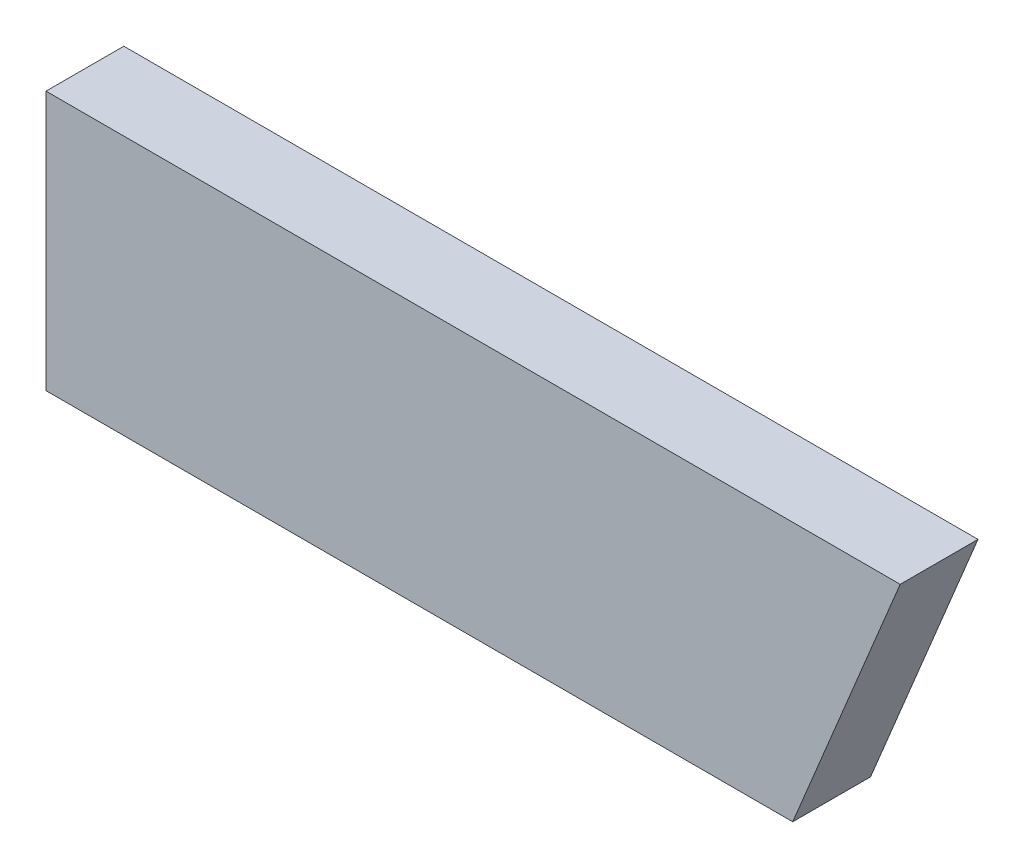
from build123d import *

# Parameters (mm, degrees)
BOSS_EXTRUDE1_DEPTH = 19.05


with BuildPart() as part:
    # Sketch2 → Boss-Extrude1 (new body)
    with BuildSketch(Plane.XY):
        Polygon((-528.085778855, 1843.946787186), (-737.18449825, 1843.946787186), (-737.18449825, 1780.446787186), (-554.388340066, 1780.446787186), align=None)
    extrude(amount=BOSS_EXTRUDE1_DEPTH)


solid = part.part
